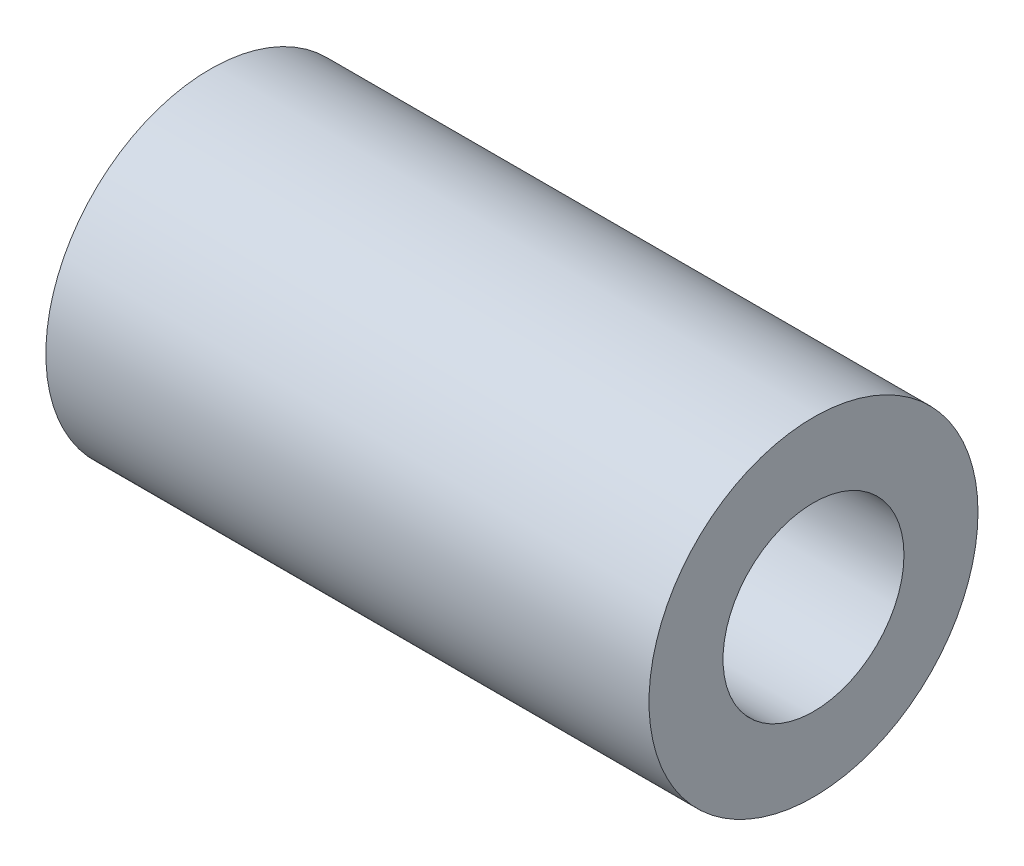
from build123d import *

# Parameters (mm, degrees)
ESBO_O1_W                 = 11
ESBO_O1_H                 = 3
FURO_ROSCADO_DE_M41_D     = 3.3
FURO_ROSCADO_DE_M41_DEPTH = 8
FURO_ROSCADO_DE_M41_TIP   = 0.991420021


with BuildPart() as part:
    # Esboço1 → Revolução1 (revolve)
    with BuildSketch(Plane.XY, mode=Mode.PRIVATE) as revolu_o1_sk:
        with Locations((5.5, 1.5)):
            Rectangle(ESBO_O1_W, ESBO_O1_H)
    revolve(revolu_o1_sk.sketch.rotate(Axis((11, 0, 0), (-1, 0, 0)), 90), axis=Axis((11, 0, 0), (-1, 0, 0)))

    # Furo roscado de M41
    with Locations(Plane(origin=(11, 0, 0), x_dir=(0, 0, -1), z_dir=(1, 0, 0))):
        with Locations((0, 0)):
            Hole(FURO_ROSCADO_DE_M41_D / 2, depth=FURO_ROSCADO_DE_M41_DEPTH)
            with Locations((0, 0, -(FURO_ROSCADO_DE_M41_DEPTH + FURO_ROSCADO_DE_M41_TIP / 2))):  # 118° drill point
                Cone(0, FURO_ROSCADO_DE_M41_D / 2, FURO_ROSCADO_DE_M41_TIP, mode=Mode.SUBTRACT)


solid = part.part
